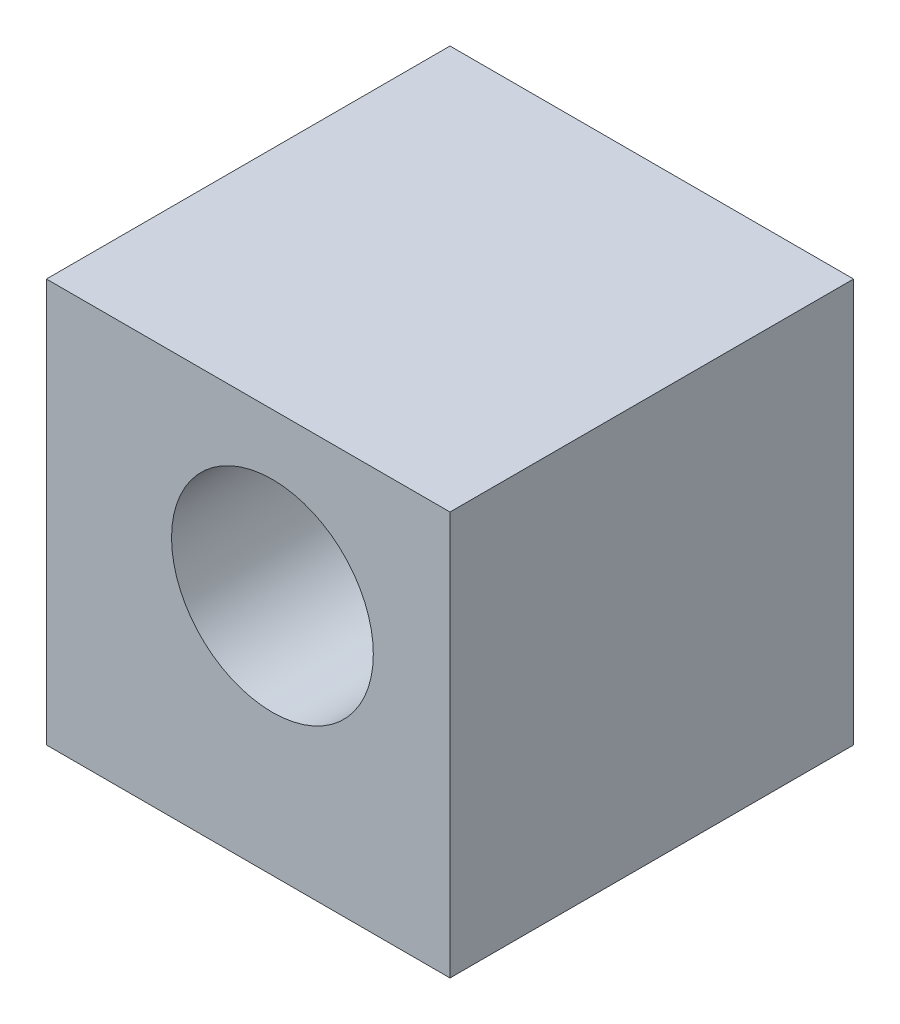
from build123d import *

# Parameters (mm, degrees)
SCHIZZO2_W                   = 30
SCHIZZO2_H                   = 30
SCHIZZO2_R                   = 7.5
ESTRUSIONE_ESTRUSIONE1_DEPTH = 30
SCHIZZO3_R                   = 4
TAGLIO_ESTRUSIONE1_DEPTH     = 13
SCHIZZO5_R                   = 4
TAGLIO_ESTRUSIONE2_DEPTH     = 12


with BuildPart() as part:
    # Schizzo2 → Estrusione-Estrusione1 (new body)
    with BuildSketch(Plane.XY):
        Rectangle(SCHIZZO2_W, SCHIZZO2_H)
        with Locations((1.8, 3)):
            Circle(SCHIZZO2_R, mode=Mode.SUBTRACT)
    extrude(amount=-ESTRUSIONE_ESTRUSIONE1_DEPTH)

    # Schizzo3 → Taglio-Estrusione1 (cut)
    with BuildSketch(Plane.ZY.offset(15)):
        with Locations((-15, -5)):
            Circle(SCHIZZO3_R)
    extrude(amount=-TAGLIO_ESTRUSIONE1_DEPTH, mode=Mode.SUBTRACT)

    # Schizzo5 → Taglio-Estrusione2 (cut)
    with BuildSketch(Plane.XZ.offset(15)):
        with Locations(Location((5, -15, 0), (0, 0, 270))):
            Circle(SCHIZZO5_R)
    extrude(amount=-TAGLIO_ESTRUSIONE2_DEPTH, mode=Mode.SUBTRACT)


solid = part.part
